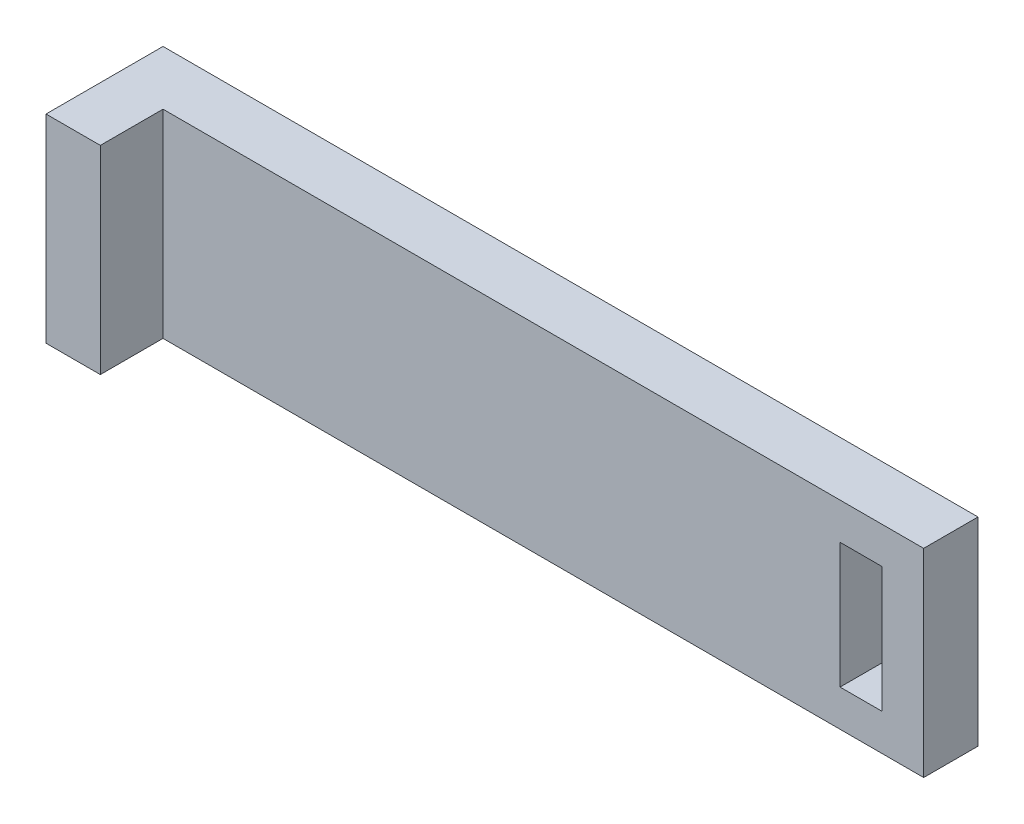
from build123d import *

# Parameters (mm, degrees)
SKETCH1_W           = 39
SKETCH1_H           = 9.5
BOSS_EXTRUDE1_DEPTH = 2.6
SKETCH3_W           = 2.6
SKETCH3_H           = 9.5
BOSS_EXTRUDE2_DEPTH = 3
SKETCH4_W           = 2
SKETCH4_H           = 6
CUT_EXTRUDE1_DEPTH  = 4


with BuildPart() as part:
    # Sketch1 → Boss-Extrude1 (new body)
    with BuildSketch(Plane.XY):
        with Locations((-13.141843972, 13.308510638)):
            Rectangle(SKETCH1_W, SKETCH1_H)
    extrude(amount=BOSS_EXTRUDE1_DEPTH)

    # Sketch3 → Boss-Extrude2 (add)
    with BuildSketch(Plane.XY.offset(2.6)):
        with Locations((-31.341843972, 13.308510638)):
            Rectangle(SKETCH3_W, SKETCH3_H)
    extrude(amount=BOSS_EXTRUDE2_DEPTH)

    # Sketch4 → Cut-Extrude1 (cut)
    with BuildSketch(Plane(origin=(0, 0, 0), x_dir=(-1, 0, 0), z_dir=(0, 0, -1))):
        with Locations((-3.358156028, 13.308510638)):
            Rectangle(SKETCH4_W, SKETCH4_H)
    extrude(amount=-CUT_EXTRUDE1_DEPTH, mode=Mode.SUBTRACT)


solid = part.part
